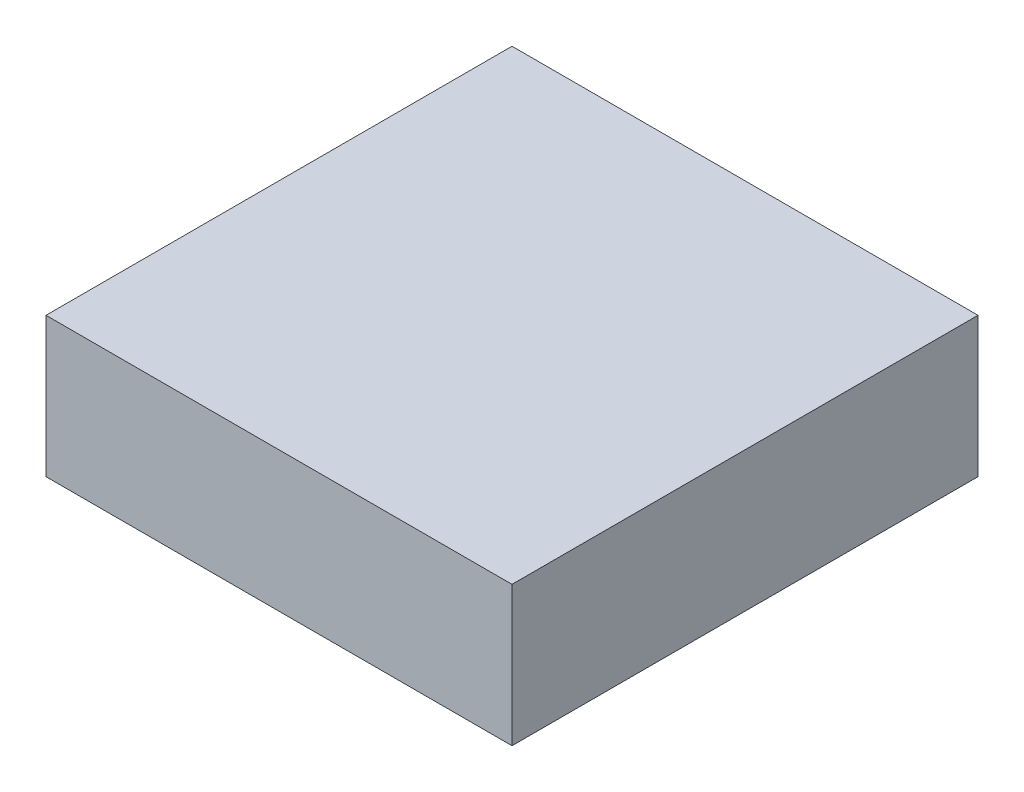
from build123d import *

# Parameters (mm, degrees)
SKETCH_1_W      = 20
SKETCH_1_H      = 20
EXTRUDE_1_DEPTH = 6


with BuildPart() as part:
    # 草图1 → 凸台-拉伸1 (new body)
    with BuildSketch(Plane(origin=(-4.800672784, 0, -9.603143473), x_dir=(1, 0, 0), z_dir=(0, 1, 0))):
        with Locations((-169.946642006, 73.081957783)):
            Rectangle(SKETCH_1_W, SKETCH_1_H)
    extrude(amount=EXTRUDE_1_DEPTH)


solid = part.part
